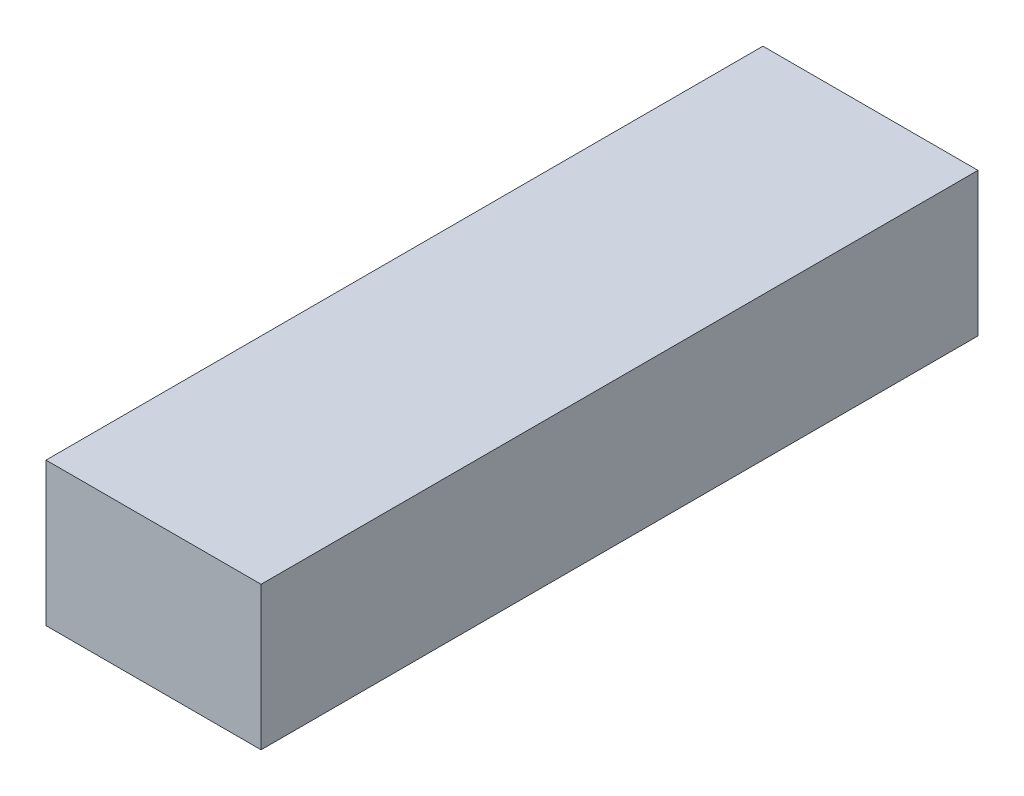
from build123d import *

# Parameters (mm, degrees)
SKETCH1_W           = 6
SKETCH1_H           = 4
BOSS_EXTRUDE1_DEPTH = 20


with BuildPart() as part:
    # Sketch1 → Boss-Extrude1 (new body)
    with BuildSketch(Plane.XY):
        Rectangle(SKETCH1_W, SKETCH1_H)
    extrude(amount=-BOSS_EXTRUDE1_DEPTH)


solid = part.part
